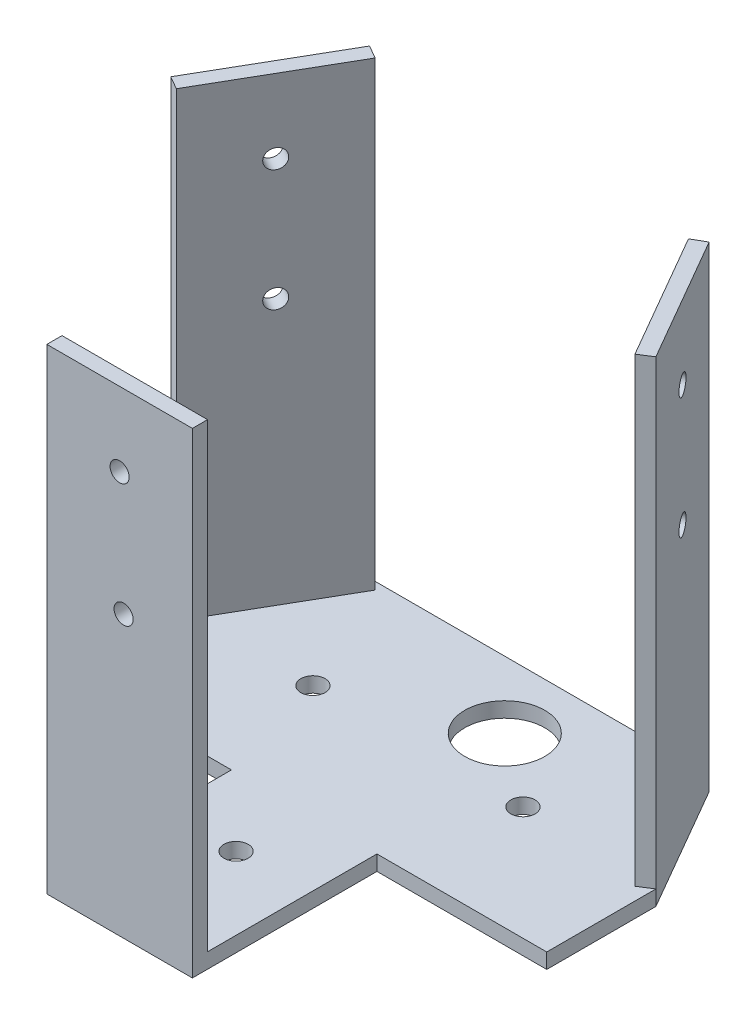
from build123d import *

# Parameters (mm, degrees)
SKETCH1_R           = 1.27
BOSS_EXTRUDE2_DEPTH = 1.5875
SKETCH2_W           = 15.24
SKETCH2_H           = 1.5875
BOSS_EXTRUDE3_DEPTH = 48.26
SKETCH3_R           = 4.191
CUT_EXTRUDE1_DEPTH  = 2.54
SKETCH4_R           = 1
CUT_EXTRUDE2_DEPTH  = 2.54
SKETCH5_R           = 1
CUT_EXTRUDE3_DEPTH  = 2.54
SKETCH6_R           = 1
CUT_EXTRUDE4_DEPTH  = 2.54


with BuildPart() as part:
    # Sketch1 → Boss-Extrude2 (new body)
    with BuildSketch(Plane(origin=(0, 0, 0), x_dir=(1, 0, 0), z_dir=(0, 1, 0))):
        Polygon((50.8, 0), (50.8, 11.43), (43.18, 24.628227154), (7.62, 24.628227154), (0, 11.43), (0, 0), (17.78, 0), (17.78, -19.327878735), (33.02, -19.327878735), (33.02, 0), align=None)
        with Locations(Location((14.401477372, 11.914121265, 0), (0, 0, 270))):
            Circle(SKETCH1_R, mode=Mode.SUBTRACT)
        with Locations(Location((36.398522628, 11.914121265, 0), (0, 0, 270))):
            Circle(SKETCH1_R, mode=Mode.SUBTRACT)
        with Locations(Location((25.4, -7.135878735, 0), (0, 0, 270))):
            Circle(SKETCH1_R, mode=Mode.SUBTRACT)
    extrude(amount=BOSS_EXTRUDE2_DEPTH)

    # Sketch2 → Boss-Extrude3 (add)
    with BuildSketch(Plane(origin=(0, 1.5875, 0), x_dir=(1, 0, 0), z_dir=(0, 1, 0))):
        with Locations((25.4, -18.534128735)):
            Rectangle(SKETCH2_W, SKETCH2_H)
        Polygon((0, 11.43), (7.62, 24.628227154), (8.994815329, 23.834477154), (1.374815329, 10.63625), align=None)
        Polygon((50.8, 11.43), (43.18, 24.628227154), (41.806418442, 23.835189471), (49.460038325, 10.578730971), align=None)
    extrude(amount=BOSS_EXTRUDE3_DEPTH)

    # Sketch3 → Cut-Extrude1 (cut)
    with BuildSketch(Plane(origin=(0, 1.5875, 0), x_dir=(1, 0, 0), z_dir=(0, 1, 0))):
        with Locations(Location((28.778522628, 17.627987154, 0), (0, 0, 270))):
            Circle(SKETCH3_R)
    extrude(amount=-CUT_EXTRUDE1_DEPTH, mode=Mode.SUBTRACT)

    # Sketch4 → Cut-Extrude2 (cut)
    with BuildSketch(Plane(origin=(43.049335183, 0, -24.854545256), x_dir=(-0.5000000000000016, 0, -0.8660254037844378), z_dir=(0.8660254037844378, 0, -0.5000000000000016))):
        with Locations((-7.881329635, 42.1025)):
            Circle(SKETCH4_R)
        with Locations((-7.881329635, 29.4025)):
            Circle(SKETCH4_R)
    extrude(amount=-CUT_EXTRUDE2_DEPTH, mode=Mode.SUBTRACT)

    # Sketch5 → Cut-Extrude3 (cut)
    with BuildSketch(Plane(origin=(-4.949335183, 0, -2.8575), x_dir=(-0.5000000000000012, 0, 0.866025403784438), z_dir=(-0.8660254037844379, 0, -0.5000000000000011))):
        with Locations((-17.518670365, 42.1025)):
            Circle(SKETCH5_R)
        with Locations((-17.518670365, 29.4025)):
            Circle(SKETCH5_R)
    extrude(amount=-CUT_EXTRUDE3_DEPTH, mode=Mode.SUBTRACT)

    # Sketch6 → Cut-Extrude4 (cut)
    with BuildSketch(Plane.XY.offset(19.327878735)):
        with Locations((25.4, 42.1025)):
            Circle(SKETCH6_R)
        with Locations((25.818223449, 29.4025)):
            Circle(SKETCH6_R)
    extrude(amount=-CUT_EXTRUDE4_DEPTH, mode=Mode.SUBTRACT)


solid = part.part
